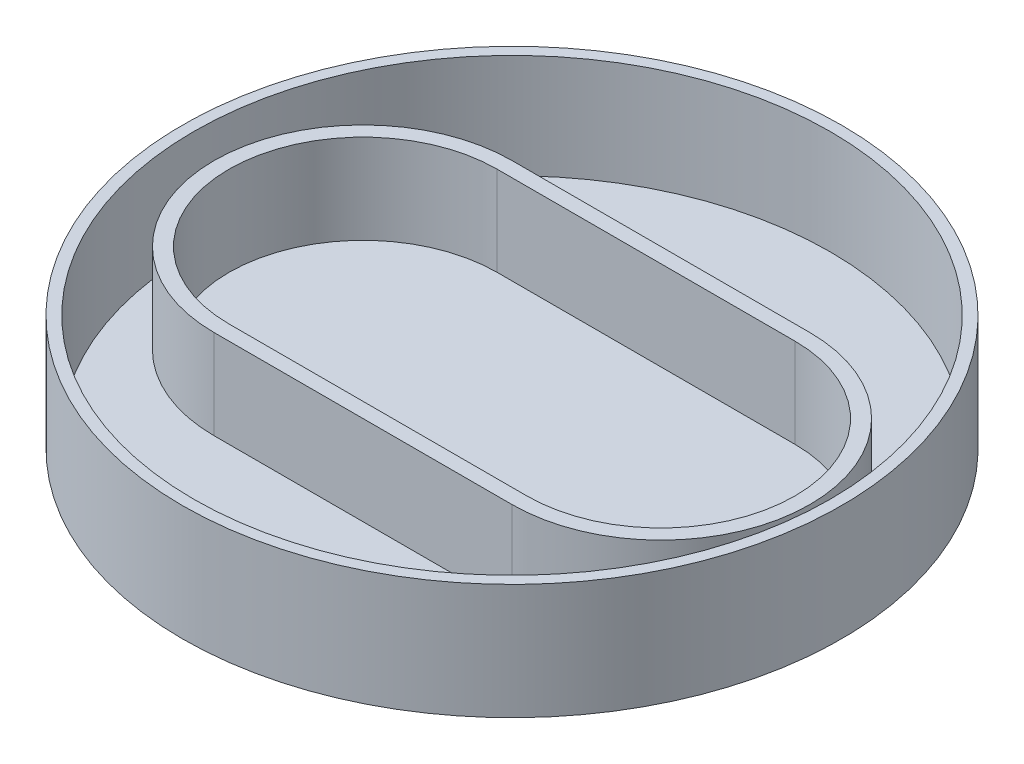
from build123d import *

# Parameters (mm, degrees)
BOSS_EXTRU_3_DEPTH = 12


with BuildPart() as part:
    # Esquisse1 → Révolution1 (revolve)
    with BuildSketch(Plane.XY, mode=Mode.PRIVATE) as r_volution1_sk:
        Polygon((0, 0), (44.25, 0), (44.25, 15.5), (42.75, 15.5), (42.75, 1.5), (0, 1.5), align=None)
    revolve(r_volution1_sk.sketch.rotate(Axis((0, 0, 0), (0, 1, 0)), 90), axis=Axis((0, 0, 0), (0, 1, 0)))

    # Esquisse4 → Boss.-Extru.3 (add)
    with BuildSketch(Plane(origin=(0, 1.5, 0), x_dir=(1, 0, 0), z_dir=(0, 1, 0))):
        with BuildLine():
            Line((20, 20), (-20, 20))
            ThreePointArc((-20, 20), (-40, 0), (-20, -20))
            Line((-20, -20), (20, -20))
            ThreePointArc((20, -20), (40, 0), (20, 20))
        make_face()
        with BuildLine():
            Line((20, -18), (-20, -18))
            ThreePointArc((-20, -18), (-38, 0), (-20, 18))
            Line((-20, 18), (20, 18))
            ThreePointArc((20, 18), (38, 0), (20, -18))
        make_face(mode=Mode.SUBTRACT)
    extrude(amount=BOSS_EXTRU_3_DEPTH)


solid = part.part
